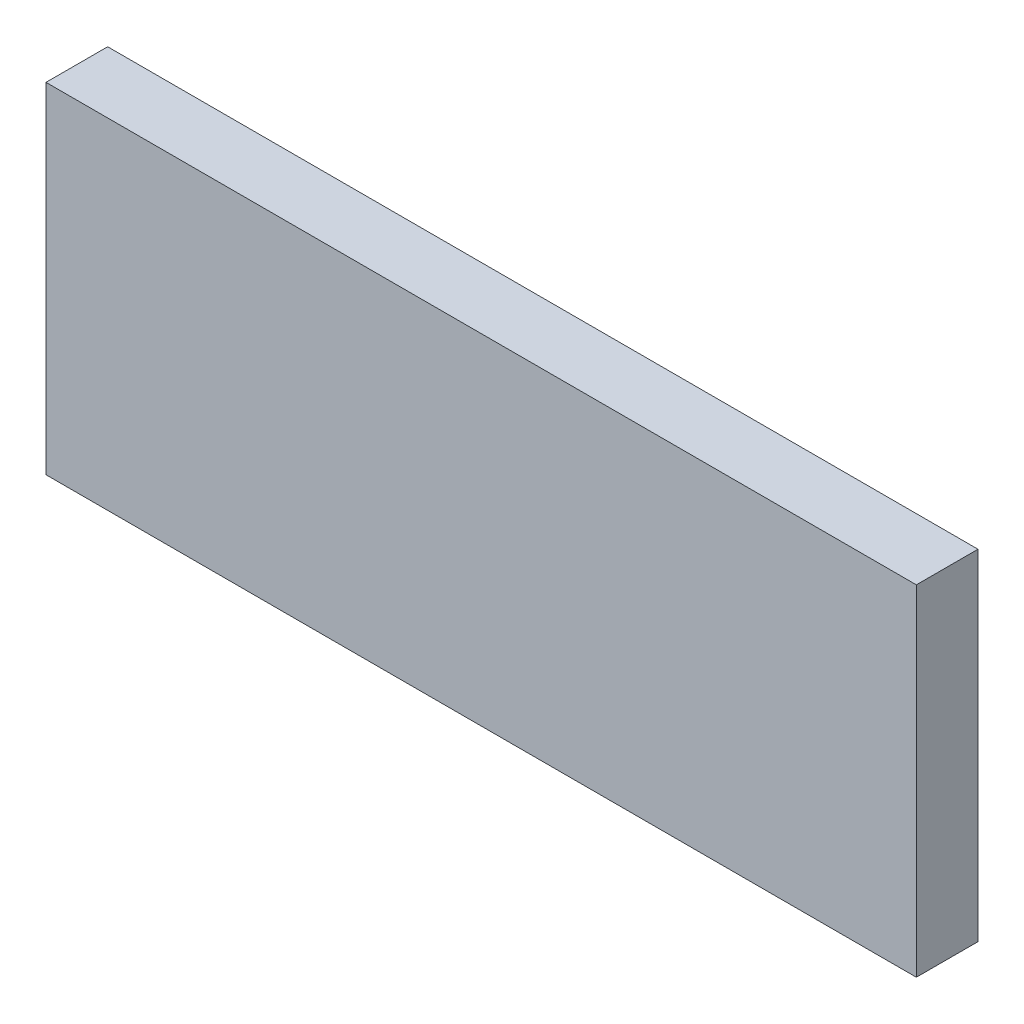
from build123d import *

# Parameters (mm, degrees)
SKETCH1_W           = 89.63
SKETCH1_H           = 35
BOSS_EXTRUDE1_DEPTH = 6.35


with BuildPart() as part:
    # Sketch1 → Boss-Extrude1 (new body)
    with BuildSketch(Plane.XY):
        Rectangle(SKETCH1_W, SKETCH1_H)
    extrude(amount=BOSS_EXTRUDE1_DEPTH)


solid = part.part
